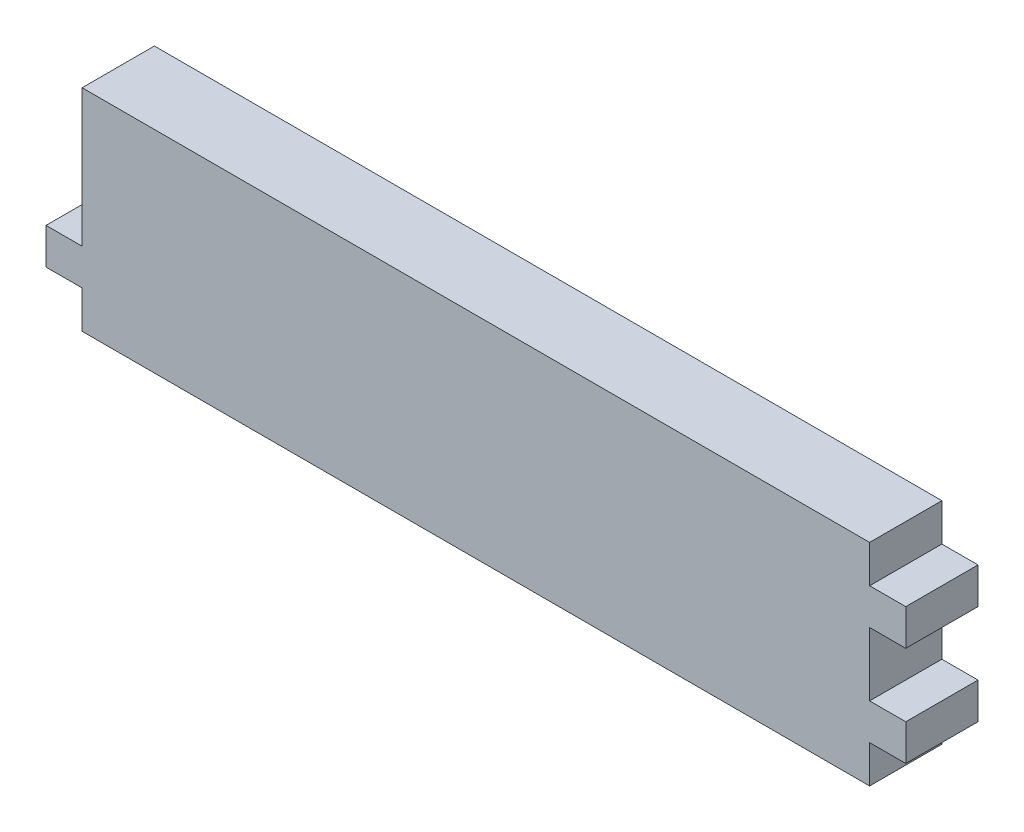
from build123d import *

# Parameters (mm, degrees)
BOSS_EXTRUDE1_DEPTH = 6.35


with BuildPart() as part:
    # Sketch1 → Boss-Extrude1 (new body)
    with BuildSketch(Plane.XY):
        Polygon((208.864432812, -3.479856336), (212.039432812, -3.479856336), (212.039432812, -0.304856336), (208.864432812, -0.304856336), (208.864432812, 5.283143664), (212.039432812, 5.283143664), (212.039432812, 8.458143664), (208.864432812, 8.458143664), (208.864432812, 11.760143664), (139.649432812, 11.760143664), (139.649432812, -0.304856336), (136.474432812, -0.304856336), (136.474432812, -3.479856336), (139.649432812, -3.479856336), (139.649432812, -6.781856336), (208.864432812, -6.781856336), align=None)
    extrude(amount=BOSS_EXTRUDE1_DEPTH)


solid = part.part
